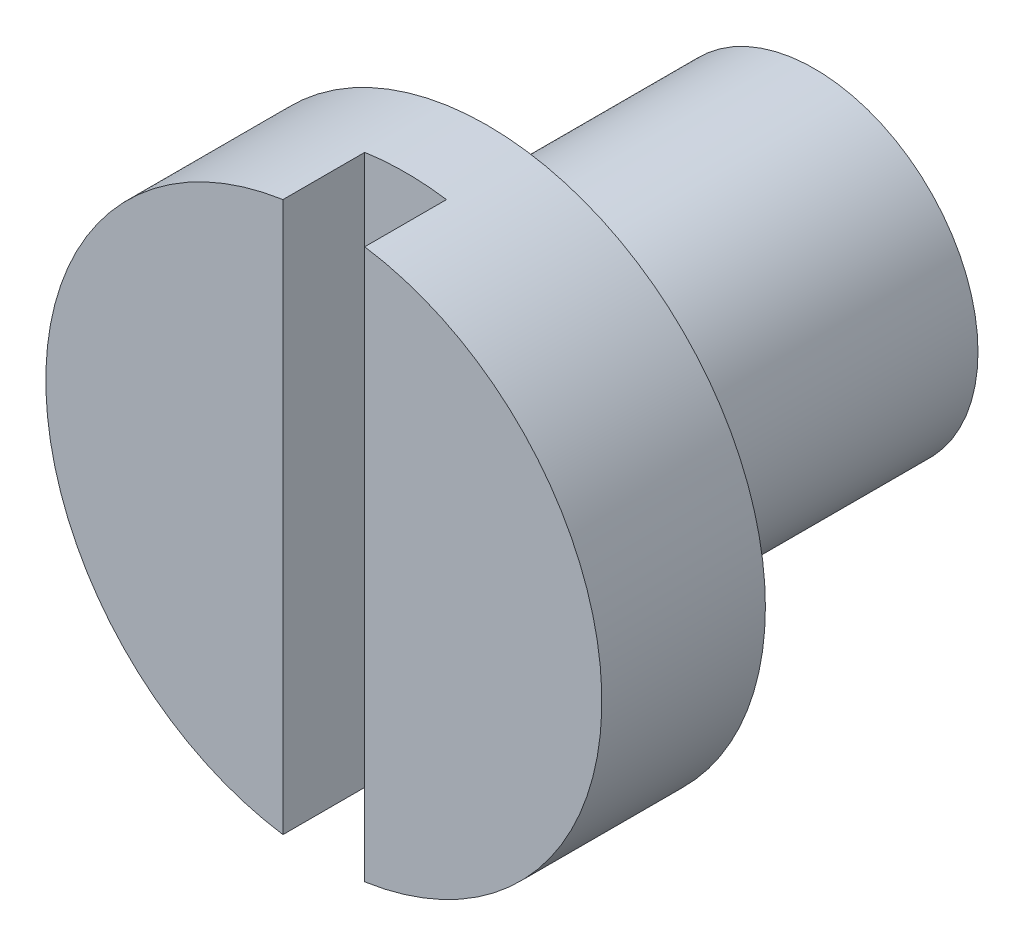
from build123d import *

# Parameters (mm, degrees)
SKETCH1_R           = 10.795
BOSS_EXTRUDE1_DEPTH = 3.175
SKETCH2_R           = 6.35
BOSS_EXTRUDE2_DEPTH = 12.7
SKETCH3_W           = 3.175
SKETCH3_H           = 25.4
CUT_EXTRUDE1_DEPTH  = 3.175


with BuildPart() as part:
    # Sketch1 → Boss-Extrude1 (new, symmetric)
    with BuildSketch(Plane.XY):
        Circle(SKETCH1_R)
    extrude(amount=BOSS_EXTRUDE1_DEPTH, both=True)

    # Sketch2 → Boss-Extrude2 (add)
    with BuildSketch(Plane(origin=(0, 0, -3.175), x_dir=(-1, 0, 0), z_dir=(0, 0, -1))):
        Circle(SKETCH2_R)
    extrude(amount=BOSS_EXTRUDE2_DEPTH)

    # Sketch3 → Cut-Extrude1 (cut)
    with BuildSketch(Plane.XY.offset(3.175)):
        Rectangle(SKETCH3_W, SKETCH3_H)
    extrude(amount=-CUT_EXTRUDE1_DEPTH, mode=Mode.SUBTRACT)


solid = part.part
